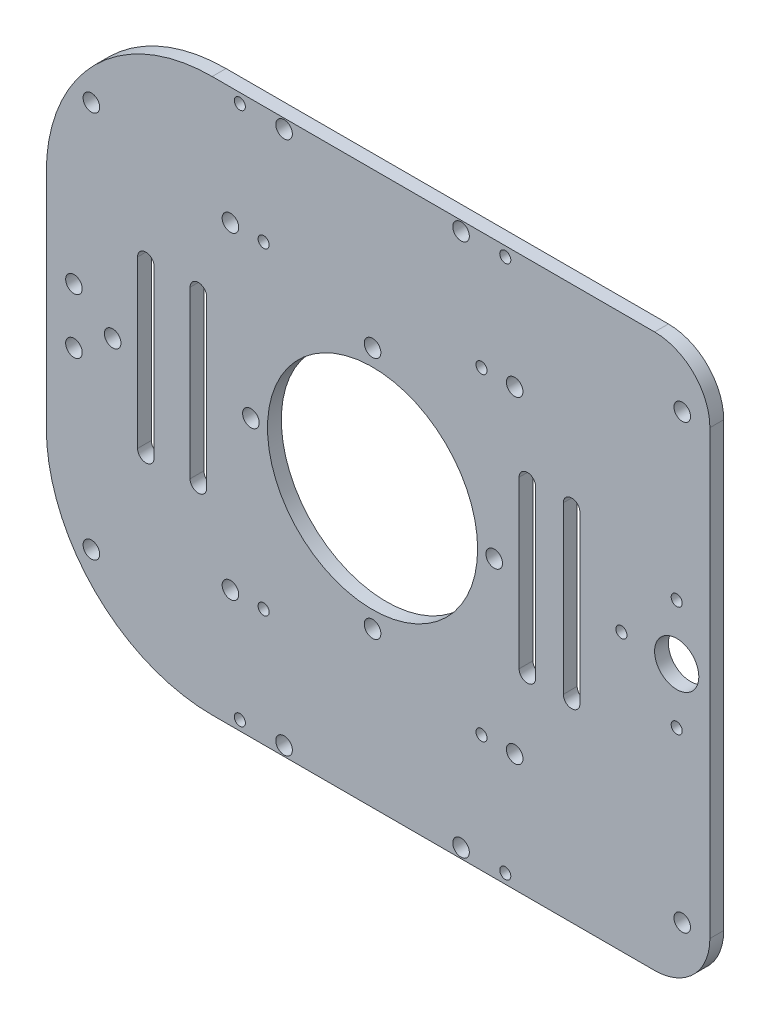
from build123d import *

# Parameters (mm, degrees)
SKETCH_1_W          = 58
SKETCH_1_H          = 100
SKETCH_1_R          = 1
SKETCH_1_R_2        = 1.5
EXTRUDE_1_DEPTH     = 2.5
SKETCH_2_R          = 19
SKETCH_2_R_2        = 1.5
CUT_EXTRUDE_1_DEPTH = 10
SKETCH_2_3_W        = 30
SKETCH_2_3_H        = 100
SKETCH_2_3_W_2      = 32
EXTRUDE_2_DEPTH     = 2.5
FILLET_1_R          = 30
FILLET_2_R          = 10
SKETCH_4_R          = 4
SKETCH_4_R_2        = 1
SKETCH_4_R_3        = 1.5
CUT_EXTRUDE_3_DEPTH = 10


with BuildPart() as part:
    # 草图1 → 凸台-拉伸1 (new body)
    with BuildSketch(Plane.XY):
        Rectangle(SKETCH_1_W, SKETCH_1_H)
        with Locations((-24, 48.25)):
            Circle(SKETCH_1_R, mode=Mode.SUBTRACT)
        with Locations((-16, 48.25)):
            Circle(SKETCH_1_R_2, mode=Mode.SUBTRACT)
        with Locations((16, 48.25)):
            Circle(SKETCH_1_R_2, mode=Mode.SUBTRACT)
        with Locations((24, 48.25)):
            Circle(SKETCH_1_R, mode=Mode.SUBTRACT)
        with Locations((-19.7, 28.75)):
            Circle(SKETCH_1_R, mode=Mode.SUBTRACT)
        with Locations((-25.7, 28.75)):
            Circle(SKETCH_1_R_2, mode=Mode.SUBTRACT)
        with Locations((19.7, 28.75)):
            Circle(SKETCH_1_R, mode=Mode.SUBTRACT)
        with Locations((25.7, 28.75)):
            Circle(SKETCH_1_R_2, mode=Mode.SUBTRACT)
        with Locations((25.7, -28.75)):
            Circle(SKETCH_1_R_2, mode=Mode.SUBTRACT)
        with Locations((24, -48.25)):
            Circle(SKETCH_1_R, mode=Mode.SUBTRACT)
        with Locations((16, -48.25)):
            Circle(SKETCH_1_R_2, mode=Mode.SUBTRACT)
        with Locations((19.7, -28.75)):
            Circle(SKETCH_1_R, mode=Mode.SUBTRACT)
        with Locations((-19.7, -28.75)):
            Circle(SKETCH_1_R, mode=Mode.SUBTRACT)
        with Locations((-25.7, -28.75)):
            Circle(SKETCH_1_R_2, mode=Mode.SUBTRACT)
        with Locations((-24, -48.25)):
            Circle(SKETCH_1_R, mode=Mode.SUBTRACT)
        with Locations((-16, -48.25)):
            Circle(SKETCH_1_R_2, mode=Mode.SUBTRACT)
    extrude(amount=EXTRUDE_1_DEPTH)

    # 草图2 → 切除-拉伸1 (cut)
    with BuildSketch(Plane.XY.offset(2.5)):
        Circle(SKETCH_2_R)
        with Locations((0, 22)):
            Circle(SKETCH_2_R_2)
        with Locations((-22, 0)):
            Circle(SKETCH_2_R_2)
        with Locations((0, -22)):
            Circle(SKETCH_2_R_2)
        with Locations((22, 0)):
            Circle(SKETCH_2_R_2)
    extrude(amount=-CUT_EXTRUDE_1_DEPTH, mode=Mode.SUBTRACT)

    # 草图2<3> → 凸台-拉伸2 (add)
    with BuildSketch(Plane.XY.offset(2.5)):
        with Locations((-44, 0)):
            Rectangle(SKETCH_2_3_W, SKETCH_2_3_H)
        with Locations((45, 0)):
            Rectangle(SKETCH_2_3_W_2, SKETCH_2_3_H)
    extrude(amount=-EXTRUDE_2_DEPTH)

    # 圆角1
    fillet_1_edges = [part.edges().sort_by_distance(p)[0] for p in [
        (-59, 50, 1.25),
        (-59, -50, 1.25),
    ]]
    fillet(fillet_1_edges, radius=FILLET_1_R)

    # 圆角2
    fillet_2_edges = [part.edges().sort_by_distance(p)[0] for p in [
        (61, 50, 1.25),
        (61, -50, 1.25),
    ]]
    fillet(fillet_2_edges, radius=FILLET_2_R)

    # 草图4 → 切除-拉伸3 (cut)
    with BuildSketch(Plane.XY.offset(2.5)):
        with Locations((55, 0)):
            Circle(SKETCH_4_R)
        with Locations((55, 10)):
            Circle(SKETCH_4_R_2)
        with Locations((55, -10)):
            Circle(SKETCH_4_R_2)
        with Locations((45, 0)):
            Circle(SKETCH_4_R_2)
        with Locations((-54, 5)):
            Circle(SKETCH_4_R_3)
        with Locations((-54, -5)):
            Circle(SKETCH_4_R_3)
        with Locations((-50.846052275, 35)):
            Circle(SKETCH_4_R_3)
        with Locations((56, -40)):
            Circle(SKETCH_4_R_3)
        with Locations((-50.846052275, -35)):
            Circle(SKETCH_4_R_3)
        with Locations((56, 40)):
            Circle(SKETCH_4_R_3)
        with Locations((-47, 0)):
            Circle(SKETCH_4_R_3)
        with BuildLine():
            Line((-42.5, -15), (-42.5, 15))
            ThreePointArc((-42.5, 15), (-41, 16.5), (-39.5, 15))
            Line((-39.5, 15), (-39.5, -15))
            ThreePointArc((-39.5, -15), (-41, -16.5), (-42.5, -15))
        make_face()
        with BuildLine():
            Line((-33, -15), (-33, 15))
            ThreePointArc((-33, 15), (-31.5, 16.5), (-30, 15))
            Line((-30, 15), (-30, -15))
            ThreePointArc((-30, -15), (-31.5, -16.5), (-33, -15))
        make_face()
        with BuildLine():
            Line((26.5, -15), (26.5, 15))
            ThreePointArc((26.5, 15), (28, 16.5), (29.5, 15))
            Line((29.5, 15), (29.5, -15))
            ThreePointArc((29.5, -15), (28, -16.5), (26.5, -15))
        make_face()
        with BuildLine():
            Line((34.5, -15), (34.5, 15))
            ThreePointArc((34.5, 15), (36, 16.5), (37.5, 15))
            Line((37.5, 15), (37.5, -15))
            ThreePointArc((37.5, -15), (36, -16.5), (34.5, -15))
        make_face()
    extrude(amount=-CUT_EXTRUDE_3_DEPTH, mode=Mode.SUBTRACT)


solid = part.part
